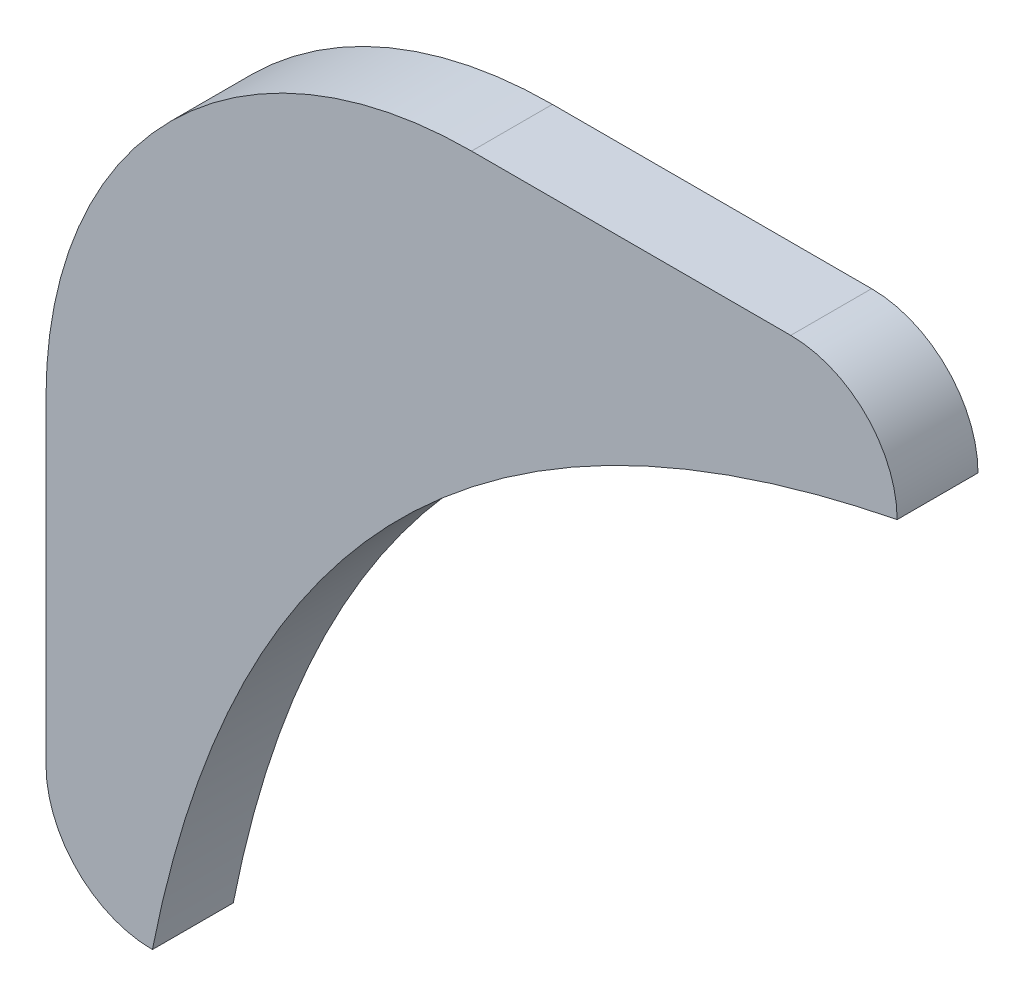
from build123d import *

# Parameters (mm, degrees)
BOSS_EXTRUDE1_DEPTH = 4.826


with BuildPart() as part:
    # Sketch1 → Boss-Extrude1 (new body)
    with BuildSketch(Plane.XY):
        with BuildLine():
            Line((0, 6.35), (0, 25.4))
            ThreePointArc((0, 25.4), (7.439487758, 43.360512242), (25.4, 50.8))
            Line((25.4, 50.8), (44.45, 50.8))
            ThreePointArc((44.45, 50.8), (48.940128061, 48.940128061), (50.8, 44.45))
            add(Edge.make_bspline(
                [(6.35, 0), (13.686894428, 37.082177492), (50.8, 44.45)],
                knots=[0, 0, 0, 1, 1, 1], degree=2))
            ThreePointArc((6.35, 0), (1.859871939, 1.859871939), (0, 6.35))
        make_face()
    extrude(amount=BOSS_EXTRUDE1_DEPTH)


solid = part.part
